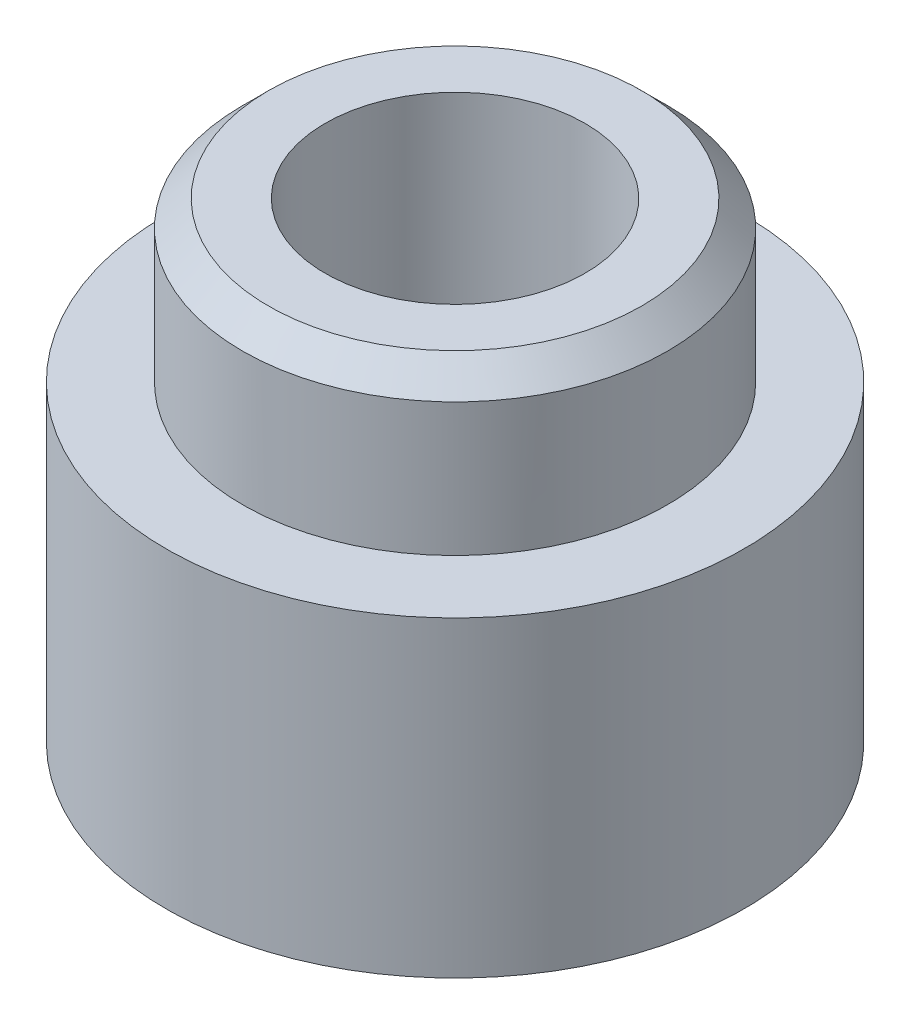
from build123d import *

# Parameters (mm, degrees)
TIP_CHAMFER_SIZE = 0.25
M3_TAPPED_HOLE_D = 2.5


with BuildPart() as part:
    # Body Sketch → Body Revolve (revolve)
    with BuildSketch(Plane.XY, mode=Mode.PRIVATE) as body_revolve_sk:
        Polygon((0, 0), (2.78, 0), (2.78, 3), (2.045, 3), (2.045, 4.53), (0, 4.53), align=None)
    revolve(body_revolve_sk.sketch.rotate(Axis((0, 4.53, 0), (0, -1, 0)), 180), axis=Axis((0, 4.53, 0), (0, -1, 0)))

    # Tip Chamfer
    tip_chamfer_edges = [part.edges().sort_by_distance(p)[0] for p in [
        (2.045, 4.53, 0),
    ]]
    chamfer(tip_chamfer_edges, length=TIP_CHAMFER_SIZE)

    # M3 Tapped Hole (through all)
    with Locations(Plane(origin=(0, 0, 0), x_dir=(-1, 0, 0), z_dir=(0, -1, 0))):
        with Locations((0, 0)):
            Hole(M3_TAPPED_HOLE_D / 2)


solid = part.part
